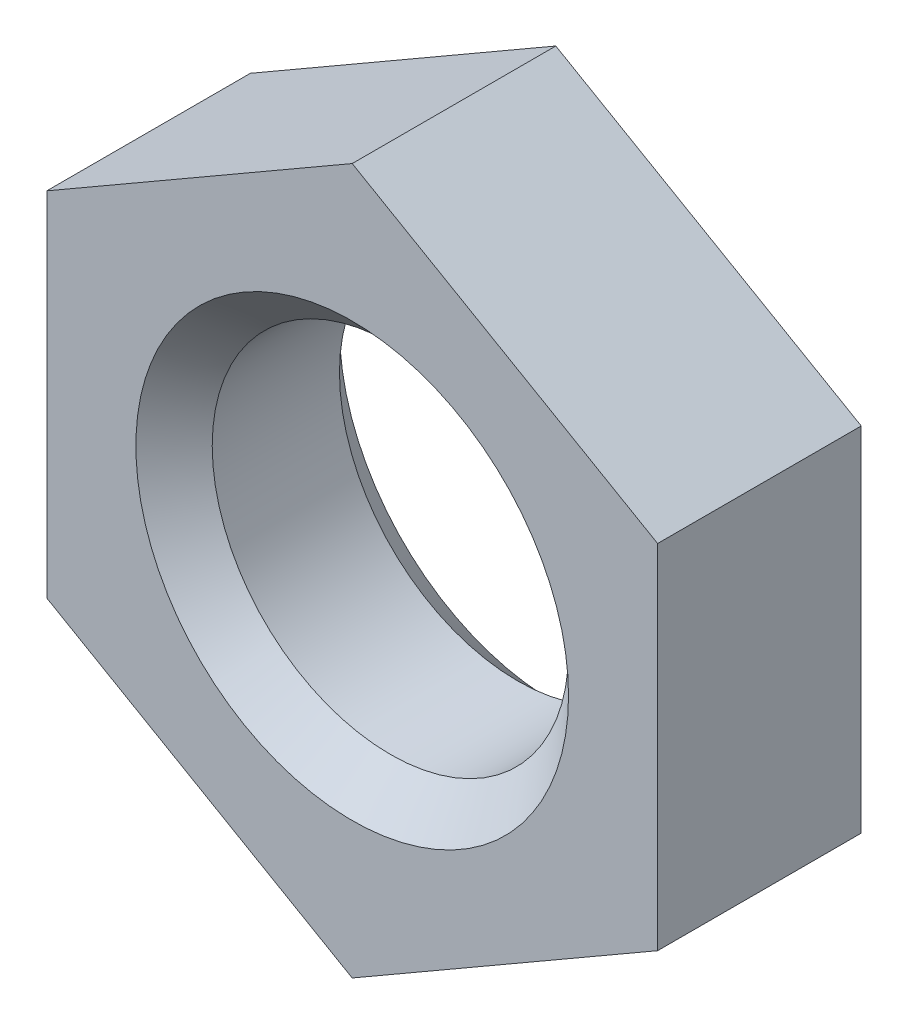
from build123d import *

# Parameters (mm, degrees)
EXTRUDE_1_DEPTH    = 8
HOLE_WIZARD_M161_D = 14
CHAMFER_1_SIZE     = 1.5


with BuildPart() as part:
    # Эскиз1 → Бобышка-Вытянуть1 (new body)
    with BuildSketch(Plane.XY):
        Polygon((0, 13.856406461), (-12, 6.92820323), (-12, -6.92820323), (0, -13.856406461), (12, -6.92820323), (12, 6.92820323), align=None)
    extrude(amount=EXTRUDE_1_DEPTH)

    # Отверстие обработанное метчиком M161 (through all)
    with Locations(Plane(origin=(0, 0, 0), x_dir=(-1, 0, 0), z_dir=(0, 0, -1))):
        with Locations((0, 0)):
            Hole(HOLE_WIZARD_M161_D / 2)

    # Фаска1
    chamfer_1_edges = [part.edges().sort_by_distance(p)[0] for p in [
        (-7, 0, 0),
        (-7, 0, 8),
    ]]
    chamfer(chamfer_1_edges, length=CHAMFER_1_SIZE)


solid = part.part
